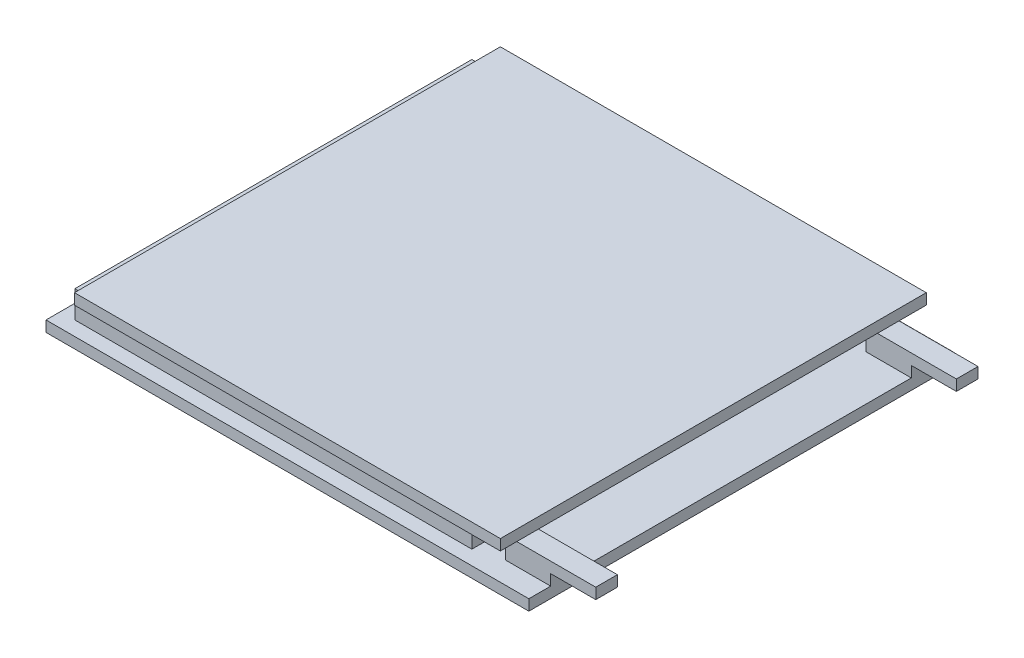
from build123d import *

# Parameters (mm, degrees)
SKETCH1_W      = 34.0106
SKETCH1_H      = 29.9974
EXTRUDE1_DEPTH = 0.762
SKETCH2_W      = 27.9654
SKETCH2_H      = 27.9654
EXTRUDE2_DEPTH = 1.905
SKETCH3_W      = 29.9974
SKETCH3_H      = 29.9974
EXTRUDE3_DEPTH = 0.762
EXTRUDE4_START = 12.7
EXTRUDE4_DEPTH = 0.762


with BuildPart() as part:
    # Sketch1 → Extrude1 (new body)
    with BuildSketch(Plane(origin=(0, 0, 0), x_dir=(1, 0, 0), z_dir=(0, 1, 0))):
        Rectangle(SKETCH1_W, SKETCH1_H)
    extrude(amount=-EXTRUDE1_DEPTH)

    # Sketch2 → Extrude2 (add)
    with BuildSketch(Plane(origin=(0, 0, 0), x_dir=(-1, 0, 0), z_dir=(0, 1, 0))):
        with Locations((2.0066, 0)):
            Rectangle(SKETCH2_W, SKETCH2_H)
    extrude(amount=EXTRUDE2_DEPTH)

    # Sketch3 → Extrude3 (add)
    with BuildSketch(Plane(origin=(0, 1.905, 0), x_dir=(-1, 0, 0), z_dir=(0, 1, 0))):
        Rectangle(SKETCH3_W, SKETCH3_H)
    extrude(amount=EXTRUDE3_DEPTH)

    # Sketch4 → Extrude4 (add, symmetric)
    with BuildSketch(Plane.XY.offset(EXTRUDE4_START)):
        Polygon((13.8303, 0), (13.8303, 1.524), (20.1803, 1.524), (20.1803, 0.762), (17.0053, 0.762), (17.0053, 0), align=None)
    extrude4 = extrude(amount=EXTRUDE4_DEPTH, both=True)

    # Mirror1: Extrude4 across plane
    add(extrude4.mirror(Plane.XY))


solid = part.part
